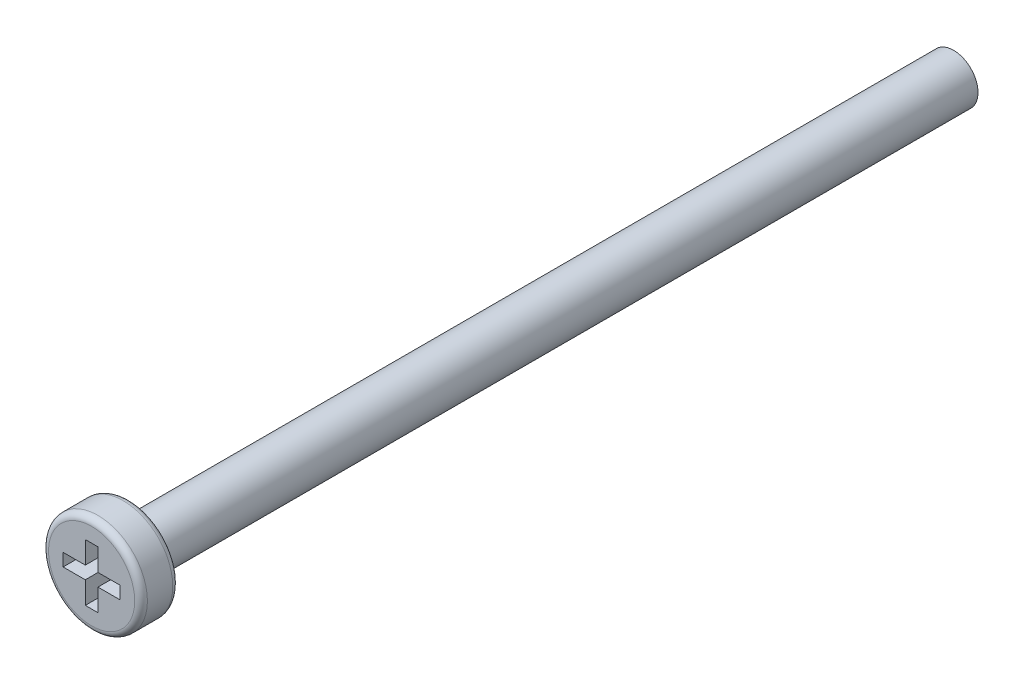
from build123d import *

# Parameters (mm, degrees)
ESBO_O5_R                = 3.9
RESSALTO_EXTRUS_O2_DEPTH = 3
CORTE_EXTRUS_O3_DEPTH    = 2
FILETE1_R                = 0.5
ESBO_O8_R                = 1.925
RESSALTO_EXTRUS_O3_DEPTH = 65


with BuildPart() as part:
    # Esboço5 → Ressalto-extrusão2 (new body)
    with BuildSketch(Plane.XY):
        Circle(ESBO_O5_R)
    extrude(amount=RESSALTO_EXTRUS_O2_DEPTH)

    # Esboço7 → Corte-extrusão3 (cut)
    with BuildSketch(Plane.XY.offset(3)):
        Polygon((-0.5, -0.5), (-2.25, -0.5), (-2.25, 0.5), (-0.5, 0.5), (-0.5, 2.25), (0.5, 2.25), (0.5, 0.5), (2.25, 0.5), (2.25, -0.5), (0.5, -0.5), (0.5, -2.25), (-0.5, -2.25), align=None)
    extrude(amount=-CORTE_EXTRUS_O3_DEPTH, mode=Mode.SUBTRACT)

    # Filete1
    filete1_edges = [part.edges().sort_by_distance(p)[0] for p in [
        (-3.9, 0, 0),
        (-3.9, 0, 3),
    ]]
    fillet(filete1_edges, radius=FILETE1_R)

    # Esboço8 → Ressalto-extrusão3 (add)
    with BuildSketch(Plane(origin=(0, 0, 0), x_dir=(-1, 0, 0), z_dir=(0, 0, -1))):
        with Locations(Location((0, 0, 0), (0, 0, 180))):
            Circle(ESBO_O8_R)
    extrude(amount=RESSALTO_EXTRUS_O3_DEPTH)


solid = part.part
